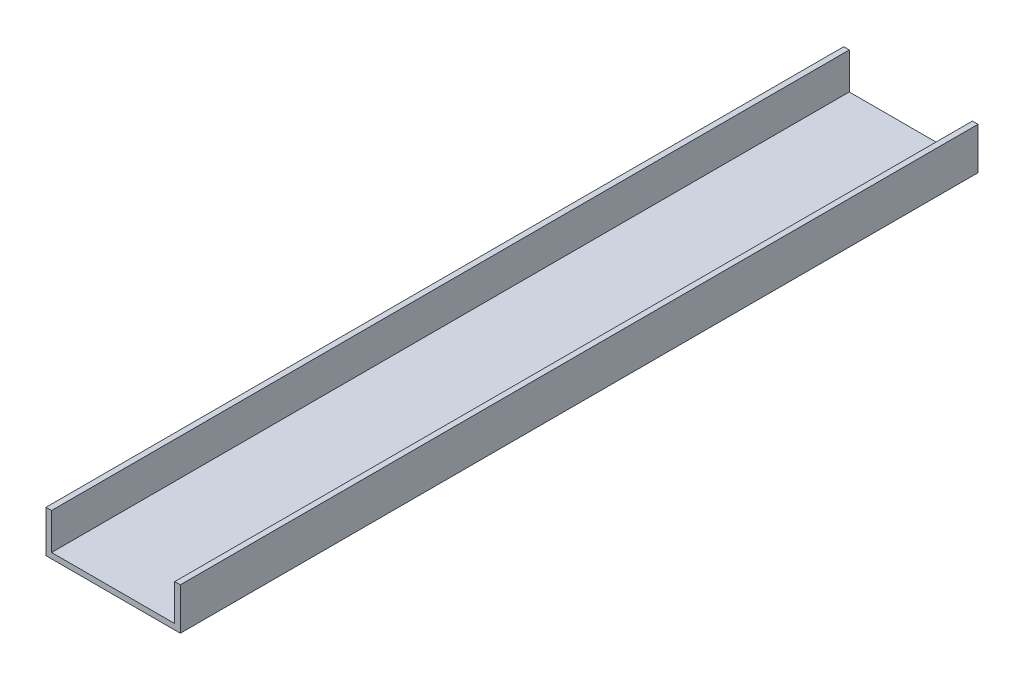
from build123d import *

# Parameters (mm, degrees)
EXTRUDE_THIN1_DEPTH = 285


with BuildPart() as part:
    # Sketch1 → Extrude-Thin1 (new body)
    with BuildSketch(Plane.XY):
        Polygon((0, 15), (0, 0), (48, 0), (48, 15), (46, 15), (46, 2), (2, 2), (2, 15), align=None)
    extrude(amount=EXTRUDE_THIN1_DEPTH)


solid = part.part
